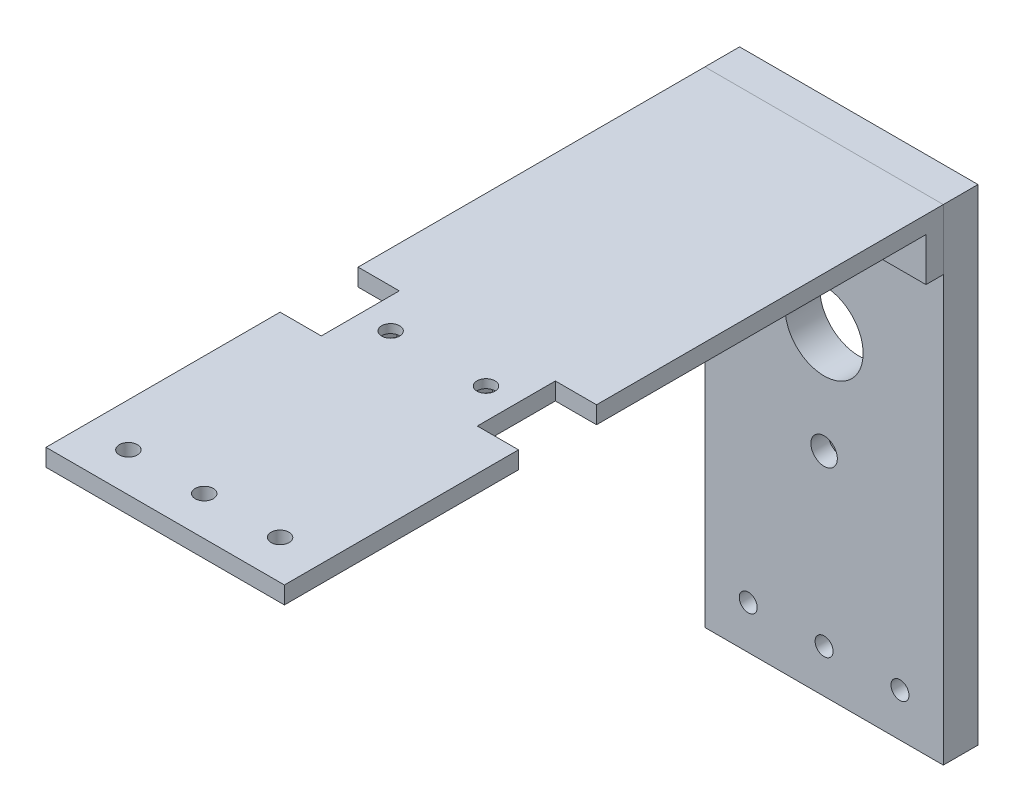
from build123d import *

# Parameters (mm, degrees)
BOSS_EXTRUDE1_DEPTH    = 55
CUT_EXTRUDE1_REACH     = 204.901
SKETCH2_R              = 9
SKETCH2_R_2            = 3.05
CUT_EXTRUDE2_DEPTH     = 4
SKETCH4_R              = 2.075
CUT_EXTRUDE3_DEPTH     = 4
CUT_EXTRUDE5_DEPTH     = 2
CUT_EXTRUDE6_REACH     = 204.901
SKETCH8_W              = 9.5
SKETCH8_H              = 18
CUT_EXTRUDE7_REACH     = 204.901
SKETCH9_R              = 2.075
CUT_EXTRUDE8_REACH     = 204.901
SKETCH10_R             = 2.075
SKETCH12_W             = 55
SKETCH12_H             = 4
BOSS_EXTRUDE2_DEPTH    = 10
SKETCH13_W             = 23
SKETCH13_H             = 7
CUT_EXTRUDE9_DEPTH     = 4
CUT_EXTRUDE10_REACH    = 195.579
SKETCH14_R             = 2.075
CUT_EXTRUDE11_DEPTH    = 3.2
SPLIT1_SURFACE_1_BACK  = 203.901
SPLIT1_SURFACE_1_DEPTH = 407.802
SPLIT1_SURFACE_2_BACK  = 203.901
SPLIT1_SURFACE_2_DEPTH = 407.802


with BuildPart() as part:
    # Sketch1 → Boss-Extrude1 (new body)
    with BuildSketch(Plane(origin=(0, 0, 0), x_dir=(0, 0, -1), z_dir=(1, 0, 0))):
        Polygon((0, 0), (160, 0), (160, -112), (152, -112), (152, -4), (0, -4), align=None)
    extrude(amount=BOSS_EXTRUDE1_DEPTH)

    # Sketch2 → Cut-Extrude1 (cut, up to next)
    with BuildSketch(Plane(origin=(0, 0, -160), x_dir=(-1, 0, 0), z_dir=(0, 0, -1)), mode=Mode.PRIVATE) as cut_extrude1_sk1:
        with Locations(Location((-27.5, -39, 0), (0, 0, 90))):
            Circle(SKETCH2_R)
    cut_extrude1_tool1 = extrude(cut_extrude1_sk1.sketch, amount=-CUT_EXTRUDE1_REACH, mode=Mode.PRIVATE) & part.part
    # Sketch2 → Cut-Extrude1 (cut, up to next)
    with BuildSketch(Plane(origin=(0, 0, -160), x_dir=(-1, 0, 0), z_dir=(0, 0, -1)), mode=Mode.PRIVATE) as cut_extrude1_sk2:
        with Locations(Location((-27.5, -63, 0), (0, 0, 90))):
            Circle(SKETCH2_R_2)
    cut_extrude1_tool2 = extrude(cut_extrude1_sk2.sketch, amount=-CUT_EXTRUDE1_REACH, mode=Mode.PRIVATE) & part.part
    # Sketch2 → Cut-Extrude1 (cut, up to next)
    with BuildSketch(Plane(origin=(0, 0, -160), x_dir=(-1, 0, 0), z_dir=(0, 0, -1)), mode=Mode.PRIVATE) as cut_extrude1_sk3:
        with Locations((-27.5, -15)):
            Circle(SKETCH2_R_2)
    cut_extrude1_tool3 = extrude(cut_extrude1_sk3.sketch, amount=-CUT_EXTRUDE1_REACH, mode=Mode.PRIVATE) & part.part
    add(cut_extrude1_tool1.solids().sort_by_distance((27.5, -39, -160))[0], mode=Mode.SUBTRACT)
    add(cut_extrude1_tool2.solids().sort_by_distance((27.5, -63, -160))[0], mode=Mode.SUBTRACT)
    add(cut_extrude1_tool3.solids().sort_by_distance((27.5, -15, -160))[0], mode=Mode.SUBTRACT)

    # Sketch3 → Cut-Extrude2 (cut)
    with BuildSketch(Plane(origin=(0, 0, -160), x_dir=(-1, 0, 0), z_dir=(0, 0, -1))):
        Polygon((-21.726497308, -15), (-24.613248654, -10), (-30.386751346, -10), (-33.273502692, -15), (-30.386751346, -20), (-24.613248654, -20), align=None)
        Polygon((-24.613248654, -68), (-21.726497308, -63), (-24.613248654, -58), (-30.386751346, -58), (-33.273502692, -63), (-30.386751346, -68), align=None)
    extrude(amount=-CUT_EXTRUDE2_DEPTH, mode=Mode.SUBTRACT)

    # Sketch4 → Cut-Extrude3 (cut)
    with BuildSketch(Plane(origin=(0, 0, 0), x_dir=(1, 0, 0), z_dir=(0, 1, 0))):
        with Locations(Location((38.5, 63, 0), (0, 0, 270))):
            Circle(SKETCH4_R)
        with Locations(Location((16.5, 63, 0), (0, 0, 90))):
            Circle(SKETCH4_R)
    extrude(amount=-CUT_EXTRUDE3_DEPTH, mode=Mode.SUBTRACT)

    # Sketch7 → Cut-Extrude5 (cut)
    with BuildSketch(Plane(origin=(0, -4, 0), x_dir=(-1, 0, 0), z_dir=(0, -1, 0))):
        Polygon((-18.520725942, 66.5), (-20.541451884, 63), (-18.520725942, 59.5), (-14.479274058, 59.5), (-12.458548116, 63), (-14.479274058, 66.5), align=None)
        Polygon((-42.541451884, 63), (-40.520725942, 59.5), (-36.479274058, 59.5), (-34.458548116, 63), (-36.479274058, 66.5), (-40.520725942, 66.5), align=None)
    extrude(amount=-CUT_EXTRUDE5_DEPTH, mode=Mode.SUBTRACT)

    # Sketch8 → Cut-Extrude6 (cut, up to next)
    with BuildSketch(Plane(origin=(0, 0, 0), x_dir=(1, 0, 0), z_dir=(0, 1, 0)), mode=Mode.PRIVATE) as cut_extrude6_sk1:
        with Locations((4.75, 63)):
            Rectangle(SKETCH8_W, SKETCH8_H)
    cut_extrude6_tool1 = extrude(cut_extrude6_sk1.sketch, amount=-CUT_EXTRUDE6_REACH, mode=Mode.PRIVATE) & part.part
    # Sketch8 → Cut-Extrude6 (cut, up to next)
    with BuildSketch(Plane(origin=(0, 0, 0), x_dir=(1, 0, 0), z_dir=(0, 1, 0)), mode=Mode.PRIVATE) as cut_extrude6_sk2:
        with Locations((50.25, 63)):
            Rectangle(SKETCH8_W, SKETCH8_H)
    cut_extrude6_tool2 = extrude(cut_extrude6_sk2.sketch, amount=-CUT_EXTRUDE6_REACH, mode=Mode.PRIVATE) & part.part
    add(cut_extrude6_tool1.solids().sort_by_distance((4.75, 0, -63))[0], mode=Mode.SUBTRACT)
    add(cut_extrude6_tool2.solids().sort_by_distance((50.25, 0, -63))[0], mode=Mode.SUBTRACT)

    # Sketch9 → Cut-Extrude7 (cut, up to next)
    with BuildSketch(Plane(origin=(0, 0, -160), x_dir=(-1, 0, 0), z_dir=(0, 0, -1)), mode=Mode.PRIVATE) as cut_extrude7_sk1:
        with Locations(Location((-45, -102, 0), (0, 0, 90))):
            Circle(SKETCH9_R)
    cut_extrude7_tool1 = extrude(cut_extrude7_sk1.sketch, amount=-CUT_EXTRUDE7_REACH, mode=Mode.PRIVATE) & part.part
    # Sketch9 → Cut-Extrude7 (cut, up to next)
    with BuildSketch(Plane(origin=(0, 0, -160), x_dir=(-1, 0, 0), z_dir=(0, 0, -1)), mode=Mode.PRIVATE) as cut_extrude7_sk2:
        with Locations(Location((-27.5, -102, 0), (0, 0, 90))):
            Circle(SKETCH9_R)
    cut_extrude7_tool2 = extrude(cut_extrude7_sk2.sketch, amount=-CUT_EXTRUDE7_REACH, mode=Mode.PRIVATE) & part.part
    # Sketch9 → Cut-Extrude7 (cut, up to next)
    with BuildSketch(Plane(origin=(0, 0, -160), x_dir=(-1, 0, 0), z_dir=(0, 0, -1)), mode=Mode.PRIVATE) as cut_extrude7_sk3:
        with Locations(Location((-10, -102, 0), (0, 0, 90))):
            Circle(SKETCH9_R)
    cut_extrude7_tool3 = extrude(cut_extrude7_sk3.sketch, amount=-CUT_EXTRUDE7_REACH, mode=Mode.PRIVATE) & part.part
    add(cut_extrude7_tool1.solids().sort_by_distance((45, -102, -160))[0], mode=Mode.SUBTRACT)
    add(cut_extrude7_tool2.solids().sort_by_distance((27.5, -102, -160))[0], mode=Mode.SUBTRACT)
    add(cut_extrude7_tool3.solids().sort_by_distance((10, -102, -160))[0], mode=Mode.SUBTRACT)

    # Sketch10 → Cut-Extrude8 (cut, up to next)
    with BuildSketch(Plane(origin=(0, 0, 0), x_dir=(1, 0, 0), z_dir=(0, 1, 0)), mode=Mode.PRIVATE) as cut_extrude8_sk1:
        with Locations(Location((10, 9, 0), (0, 0, 270))):
            Circle(SKETCH10_R)
    cut_extrude8_tool1 = extrude(cut_extrude8_sk1.sketch, amount=-CUT_EXTRUDE8_REACH, mode=Mode.PRIVATE) & part.part
    # Sketch10 → Cut-Extrude8 (cut, up to next)
    with BuildSketch(Plane(origin=(0, 0, 0), x_dir=(1, 0, 0), z_dir=(0, 1, 0)), mode=Mode.PRIVATE) as cut_extrude8_sk2:
        with Locations(Location((27.5, 9, 0), (0, 0, 270))):
            Circle(SKETCH10_R)
    cut_extrude8_tool2 = extrude(cut_extrude8_sk2.sketch, amount=-CUT_EXTRUDE8_REACH, mode=Mode.PRIVATE) & part.part
    # Sketch10 → Cut-Extrude8 (cut, up to next)
    with BuildSketch(Plane(origin=(0, 0, 0), x_dir=(1, 0, 0), z_dir=(0, 1, 0)), mode=Mode.PRIVATE) as cut_extrude8_sk3:
        with Locations(Location((45, 9, 0), (0, 0, 270))):
            Circle(SKETCH10_R)
    cut_extrude8_tool3 = extrude(cut_extrude8_sk3.sketch, amount=-CUT_EXTRUDE8_REACH, mode=Mode.PRIVATE) & part.part
    add(cut_extrude8_tool1.solids().sort_by_distance((10, 0, -9))[0], mode=Mode.SUBTRACT)
    add(cut_extrude8_tool2.solids().sort_by_distance((27.5, 0, -9))[0], mode=Mode.SUBTRACT)
    add(cut_extrude8_tool3.solids().sort_by_distance((45, 0, -9))[0], mode=Mode.SUBTRACT)

    # Sketch12 → Boss-Extrude2 (add)
    with BuildSketch(Plane.XZ.offset(4)):
        with Locations((27.5, -150)):
            Rectangle(SKETCH12_W, SKETCH12_H)
    extrude(amount=BOSS_EXTRUDE2_DEPTH)

    # Sketch13 → Cut-Extrude9 (cut)
    with BuildSketch(Plane.XY.offset(-148)):
        with Locations((27.5, -10.5)):
            Rectangle(SKETCH13_W, SKETCH13_H)
    extrude(amount=-CUT_EXTRUDE9_DEPTH, mode=Mode.SUBTRACT)

    # Sketch14 → Cut-Extrude10 (cut, up to next)
    with BuildSketch(Plane.XY.offset(-148), mode=Mode.PRIVATE) as cut_extrude10_sk1:
        with Locations((8, -9)):
            Circle(SKETCH14_R)
    cut_extrude10_tool1 = extrude(cut_extrude10_sk1.sketch, amount=-CUT_EXTRUDE10_REACH, mode=Mode.PRIVATE) & part.part
    # Sketch14 → Cut-Extrude10 (cut, up to next)
    with BuildSketch(Plane.XY.offset(-148), mode=Mode.PRIVATE) as cut_extrude10_sk2:
        with Locations(Location((47, -9, 0), (0, 0, 270))):
            Circle(SKETCH14_R)
    cut_extrude10_tool2 = extrude(cut_extrude10_sk2.sketch, amount=-CUT_EXTRUDE10_REACH, mode=Mode.PRIVATE) & part.part
    add(cut_extrude10_tool1.solids().sort_by_distance((8, -9, -148))[0], mode=Mode.SUBTRACT)
    add(cut_extrude10_tool2.solids().sort_by_distance((47, -9, -148))[0], mode=Mode.SUBTRACT)

    # Sketch15 → Cut-Extrude11 (cut)
    with BuildSketch(Plane(origin=(0, 0, -160), x_dir=(-1, 0, 0), z_dir=(0, 0, -1))):
        Polygon((-42.958548116, -9), (-44.979274058, -5.5), (-49.020725942, -5.5), (-51.041451884, -9), (-49.020725942, -12.5), (-44.979274058, -12.5), align=None)
        Polygon((-3.958548116, -9), (-5.979274058, -5.5), (-10.020725942, -5.5), (-12.041451884, -9), (-10.020725942, -12.5), (-5.979274058, -12.5), align=None)
    extrude(amount=-CUT_EXTRUDE11_DEPTH, mode=Mode.SUBTRACT)


with BuildPart() as body_2:
    # Split1: the piece behind the surface
    add(part.part)
    # Split1 surface: a surface, the sketch's curves swept straight by 407.802 mm
    with BuildLine(Plane.ZY.offset(-SPLIT1_SURFACE_1_BACK), mode=Mode.PRIVATE) as split1_surface_1_path:
        Line((-152, -14), (-152, 0))
    split1_surface_1 = Shell.extrude(split1_surface_1_path.wire(), (-1 * SPLIT1_SURFACE_1_DEPTH, 0 * SPLIT1_SURFACE_1_DEPTH, 0 * SPLIT1_SURFACE_1_DEPTH))
    split(bisect_by=split1_surface_1, keep=Keep.BOTTOM)


with BuildPart() as part_1:
    add(part.part)

    # Split1: split by a surface, the side it looks to stays
    # Split1 surface: a surface, the sketch's curves swept straight by 407.802 mm
    with BuildLine(Plane.ZY.offset(-SPLIT1_SURFACE_2_BACK), mode=Mode.PRIVATE) as split1_surface_2_path:
        Line((-152, -14), (-152, 0))
    split1_surface_2 = Shell.extrude(split1_surface_2_path.wire(), (-1 * SPLIT1_SURFACE_2_DEPTH, 0 * SPLIT1_SURFACE_2_DEPTH, 0 * SPLIT1_SURFACE_2_DEPTH))
    split(bisect_by=split1_surface_2, keep=Keep.TOP)


solid = Compound([body_2.part, part_1.part])
